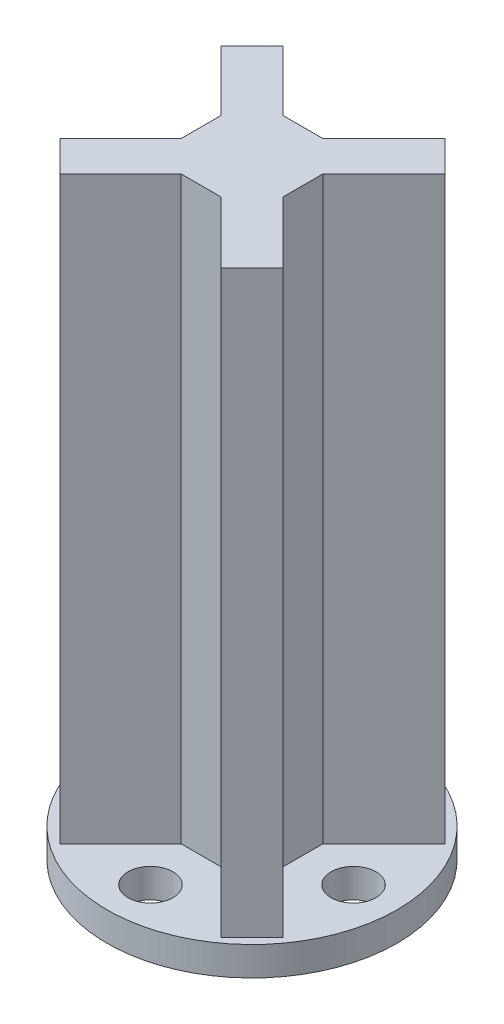
from build123d import *

# Parameters (mm, degrees)
SKETCH1_R             = 10
SKETCH1_R_2           = 1.55
BOSS_EXTRUDE1_DEPTH   = 2
BOSS_EXTRUDE2_DEPTH   = 40
BODY_MOVE_COPY1_ANGLE = 90


with BuildPart() as part:
    # Sketch1 → Boss-Extrude1 (new body)
    with BuildSketch(Plane.XY):
        Circle(SKETCH1_R)
        with Locations((-7, 0)):
            Circle(SKETCH1_R_2, mode=Mode.SUBTRACT)
        with Locations((0, 7)):
            Circle(SKETCH1_R_2, mode=Mode.SUBTRACT)
        with Locations((0, -7)):
            Circle(SKETCH1_R_2, mode=Mode.SUBTRACT)
        with Locations((7, 0)):
            Circle(SKETCH1_R_2, mode=Mode.SUBTRACT)
    extrude(amount=BOSS_EXTRUDE1_DEPTH)

    # Sketch2 → Boss-Extrude2 (add)
    with BuildSketch(Plane.XY.offset(2)):
        Polygon((-1.378679656, -3.5), (1.378679656, -3.5), (5.603334512, -7.724654855), (7.724654855, -5.603334512), (3.5, -1.378679656), (3.5, 1.378679656), (7.705979833, 5.584659489), (5.584659489, 7.705979833), (1.378679656, 3.5), (-1.378679656, 3.5), (-5.520339389, 7.641659733), (-7.641659733, 5.520339389), (-3.5, 1.378679656), (-3.5, -1.378679656), (-7.683338011, -5.562017667), (-5.562017667, -7.683338011), align=None)
    extrude(amount=BOSS_EXTRUDE2_DEPTH)


with BuildPart() as part_1:
    # Body-Move/Copy1: moved
    add(part.part.rotate(Axis((0, 0, 21), (-1, 0, 0)), BODY_MOVE_COPY1_ANGLE))


solid = part_1.part
